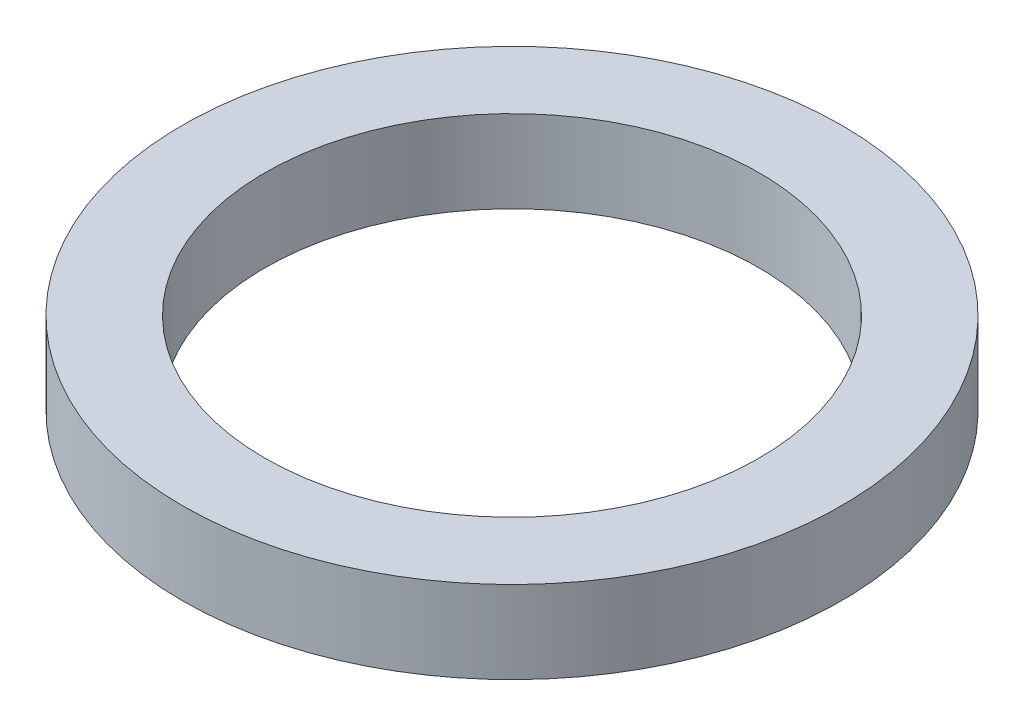
from build123d import *

# Parameters (mm, degrees)
SKETCH1_R           = 4
SKETCH1_R_2         = 3
BOSS_EXTRUDE1_DEPTH = 1


with BuildPart() as part:
    # Sketch1 → Boss-Extrude1 (new body)
    with BuildSketch(Plane(origin=(0, 0, 0), x_dir=(1, 0, 0), z_dir=(0, 1, 0))):
        with Locations(Location((0, 0, 0), (0, 0, 270))):
            Circle(SKETCH1_R)
        with Locations(Location((0, 0, 0), (0, 0, 270))):
            Circle(SKETCH1_R_2, mode=Mode.SUBTRACT)
    extrude(amount=BOSS_EXTRUDE1_DEPTH)


solid = part.part
